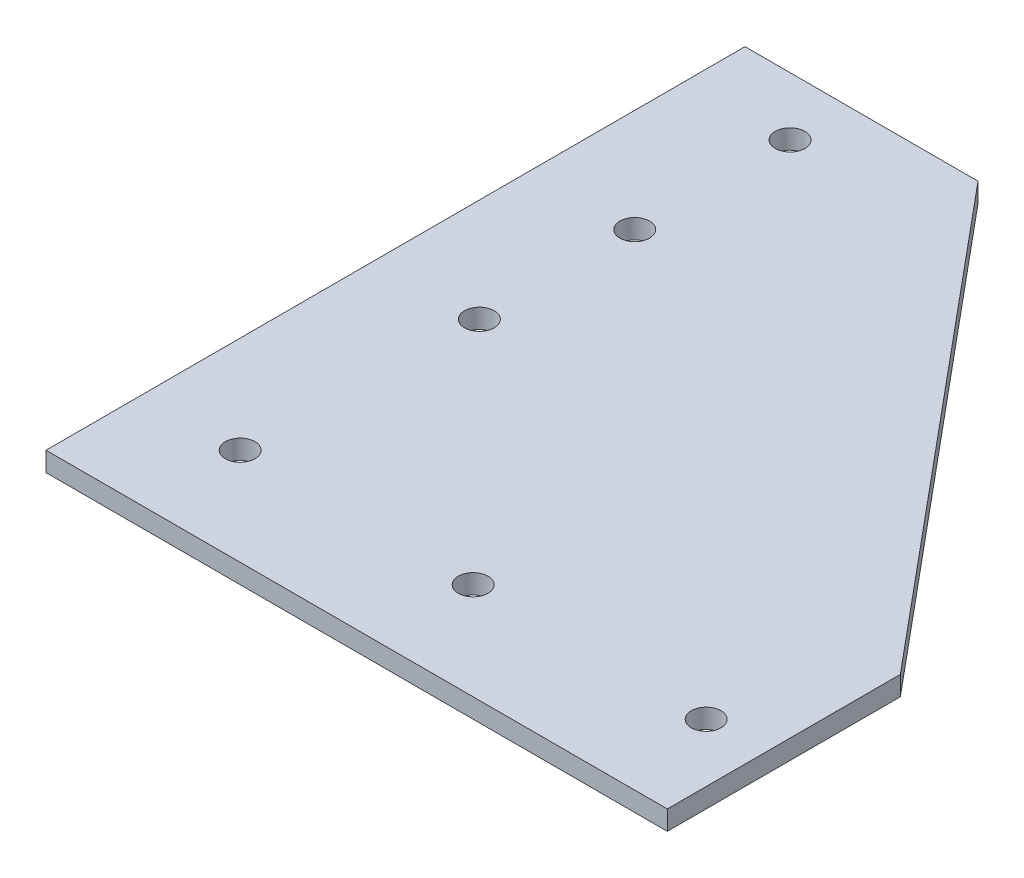
from build123d import *

# Parameters (mm, degrees)
SKETCH1_R           = 2.4257
BOSS_EXTRUDE1_DEPTH = 3.175


with BuildPart() as part:
    # Sketch1 → Boss-Extrude1 (new body)
    with BuildSketch(Plane(origin=(0, 0, 0), x_dir=(1, 0, 0), z_dir=(0, 1, 0))):
        Polygon((0, 0), (0, 114.3), (38.1, 114.3), (101.6, 38.1), (101.6, 0), align=None)
        with Locations(Location((15.875, 15.875, 0), (0, 0, 270))):
            Circle(SKETCH1_R, mode=Mode.SUBTRACT)
        with Locations(Location((53.975, 15.875, 0), (0, 0, 270))):
            Circle(SKETCH1_R, mode=Mode.SUBTRACT)
        with Locations(Location((92.075, 15.875, 0), (0, 0, 270))):
            Circle(SKETCH1_R, mode=Mode.SUBTRACT)
        with Locations(Location((16.891, 53.975, 0), (0, 0, 270))):
            Circle(SKETCH1_R, mode=Mode.SUBTRACT)
        with Locations(Location((16.891, 79.375, 0), (0, 0, 270))):
            Circle(SKETCH1_R, mode=Mode.SUBTRACT)
        with Locations(Location((16.891, 104.775, 0), (0, 0, 270))):
            Circle(SKETCH1_R, mode=Mode.SUBTRACT)
    extrude(amount=BOSS_EXTRUDE1_DEPTH)


solid = part.part
